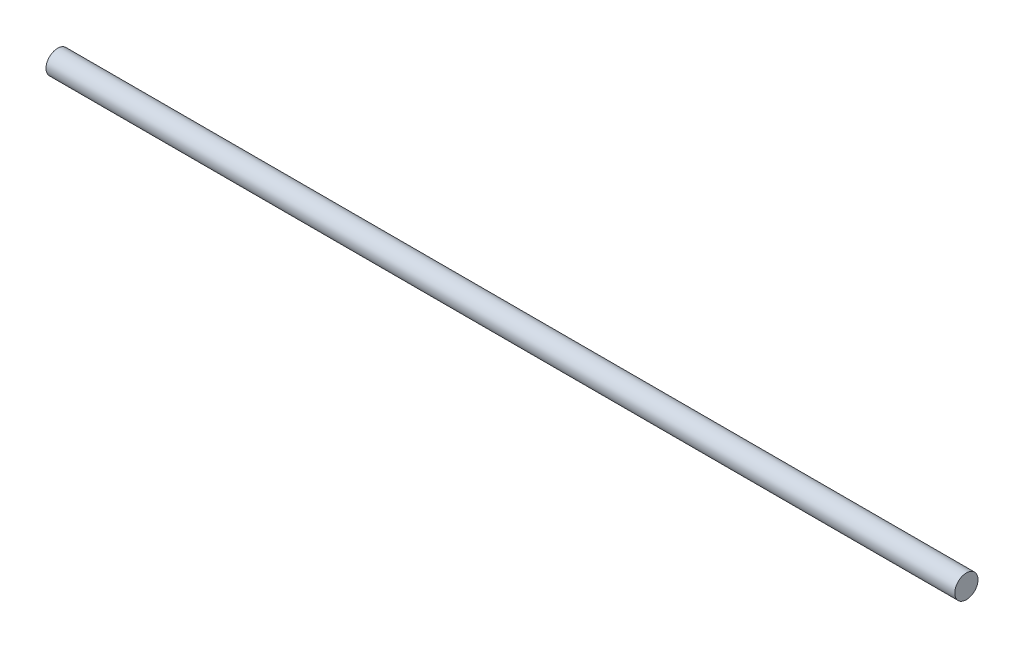
from build123d import *

# Parameters (mm, degrees)
SKETCH1_R           = 1.016
BOSS_EXTRUDE1_DEPTH = 79.375


with BuildPart() as part:
    # Sketch1 → Boss-Extrude1 (new body)
    with BuildSketch(Plane(origin=(0, 0, 0), x_dir=(0, 0, -1), z_dir=(1, 0, 0))):
        with Locations(Location((0, 0, 0), (0, 0, 180))):
            Circle(SKETCH1_R)
    extrude(amount=BOSS_EXTRUDE1_DEPTH)


solid = part.part
